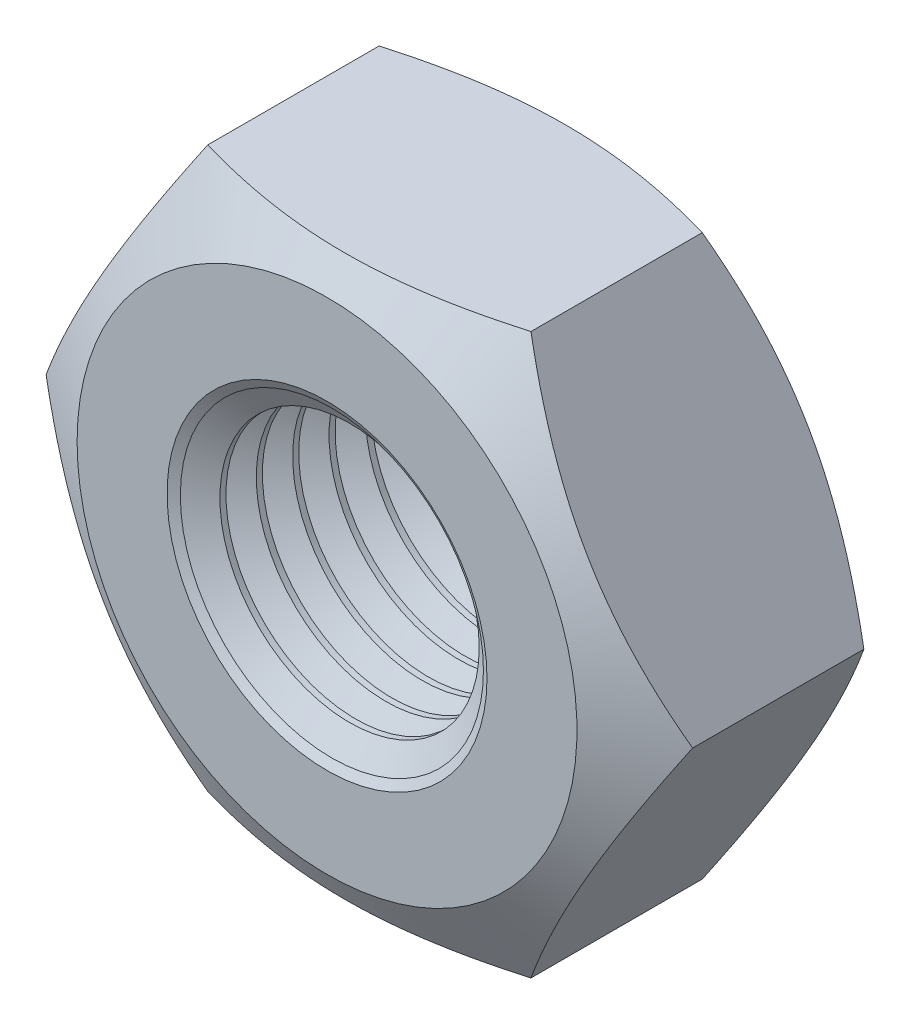
from build123d import *
from OCP.BRepFilletAPI import BRepFilletAPI_MakeChamfer

# Parameters (mm, degrees)
SKETCH1_R        = 1.621
BASENUT_DEPTH    = 3.2
ENDCHAMFER_SIZE  = 0.379
ENDCHAMFER_SIZE2 = 0.218815752
LPATTERN10_COUNT = 7
LPATTERN10_PITCH = 0.4548


with BuildPart() as part:
    # Sketch1 → BaseNut (new body)
    with BuildSketch(Plane.XY):
        Polygon((4.041451884, 0), (2.020725942, 3.5), (-2.020725942, 3.5), (-4.041451884, 0), (-2.020725942, -3.5), (2.020725942, -3.5), align=None)
        Circle(SKETCH1_R, mode=Mode.SUBTRACT)
    extrude(amount=-BASENUT_DEPTH)

    # Sketch2 → Double-Chamfer (revolve, cut)
    with BuildSketch(Plane(origin=(0, 0, 0), x_dir=(1, 0, 0), z_dir=(0, 1, 0))):
        Polygon((-4.041451884, 3.2), (-3.125, 3.2), (-4.041451884, 2.670886258), align=None)
        Polygon((-4.041451884, 0.529113742), (-4.041451884, 0), (-3.125, 0), align=None)
    revolve(axis=Axis((0, 0, -3.375940562), (0, 0, 1)), mode=Mode.SUBTRACT)

    # EndChamfer: one chamfer whose edges measure the first distance from different faces: ONE call of the kernel's chamfer builder (chamfer() names one face for all edges)
    endchamfer_edges_1 = [part.edges().sort_by_distance(p)[0] for p in [
        (-1.621, 0, -3.2),
    ]]
    endchamfer_side_1 = [part.faces().sort_by_distance(p)[0] for p in [
        (-1.621, 0, -1.6),
    ]]
    endchamfer_edges_2 = [part.edges().sort_by_distance(p)[0] for p in [
        (-1.621, 0, 0),
    ]]
    endchamfer_side_2 = [part.faces().sort_by_distance(p)[0] for p in [
        (3.036611652, 0, 0),
    ]]
    endchamfer = BRepFilletAPI_MakeChamfer(part.part.solid().wrapped)
    for e in endchamfer_edges_1:
        endchamfer.Add(ENDCHAMFER_SIZE, ENDCHAMFER_SIZE2, e.wrapped, endchamfer_side_1[0].wrapped)  # the first distance lies on this face
    for e in endchamfer_edges_2:
        endchamfer.Add(ENDCHAMFER_SIZE, ENDCHAMFER_SIZE2, e.wrapped, endchamfer_side_2[0].wrapped)  # the first distance lies on this face
    add(Compound.cast(endchamfer.Shape()), mode=Mode.REPLACE)

    # Sketch3 → Cut-Revolve10 (revolve, cut)
    with BuildSketch(Plane(origin=(0, 0, 0), x_dir=(1, 0, 0), z_dir=(0, 1, 0)), mode=Mode.PRIVATE) as cut_revolve10_sk:
        Polygon((-1.949223628, 2.821), (-1.621, 2.6315), (-1.242, 2.6315), (-1.242, 3.0105), (-1.621, 3.0105), align=None)
    cut_revolve10 = revolve(cut_revolve10_sk.sketch.rotate(Axis((0, 0, -7.438254559), (0, 0, -1)), 180), axis=Axis((0, 0, -7.438254559), (0, 0, -1)), mode=Mode.SUBTRACT)

    # LPattern10: Cut-Revolve10 ×7
    with Locations(*[(0, 0, i * LPATTERN10_PITCH) for i in range(1, LPATTERN10_COUNT)]):
        add(cut_revolve10, mode=Mode.SUBTRACT)


solid = part.part
